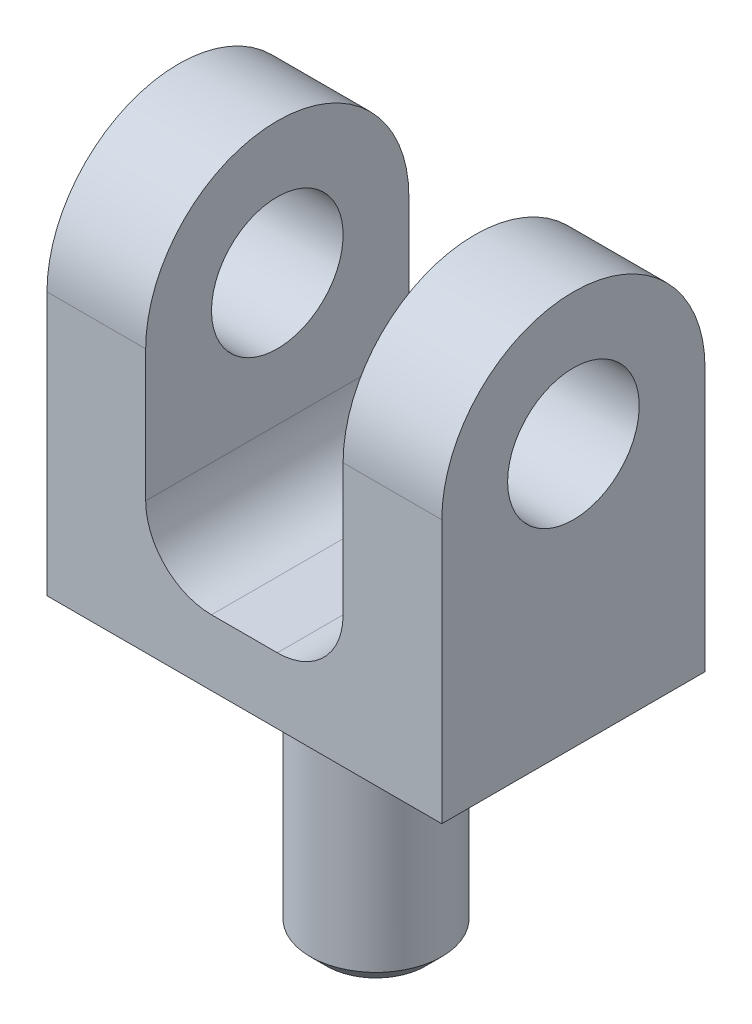
from build123d import *

# Parameters (mm, degrees)
SKETCH1_R               = 3.175
BOSS_EXTRUDE1_DEPTH     = 9.525
SKETCH2_R               = 3.175
BOSS_EXTRUDE2_DEPTH     = 12.7
CHAMFER1_SIZE           = 0.79375
CUT_EXTRUDE1_DEPTH      = 28.86051193
CUT_EXTRUDE1_DEPTH_BACK = 28.86051193
SKETCH3_W               = 9.525
SKETCH3_H               = 15.875
FILLET1_R               = 3.175


with BuildPart() as part:
    # Sketch1 → Boss-Extrude1 (new, symmetric)
    with BuildSketch(Plane(origin=(0, 0, 0), x_dir=(0, 0, -1), z_dir=(1, 0, 0))):
        with BuildLine():
            Line((-6.35, 0), (-6.35, -12.7))
            Line((-6.35, -12.7), (6.35, -12.7))
            Line((6.35, -12.7), (6.35, 0))
            ThreePointArc((6.35, 0), (0, 6.35), (-6.35, 0))
        make_face()
        with Locations(Location((0, 0, 0), (0, 0, 180))):
            Circle(SKETCH1_R, mode=Mode.SUBTRACT)
    extrude(amount=BOSS_EXTRUDE1_DEPTH, both=True)

    # Sketch2 → Boss-Extrude2 (add)
    with BuildSketch(Plane.XZ.offset(12.7)):
        with Locations(Location((0, 0, 0), (0, 0, 90))):
            Circle(SKETCH2_R)
    extrude(amount=BOSS_EXTRUDE2_DEPTH)

    # Chamfer1
    chamfer1_edges = [part.edges().sort_by_distance(p)[0] for p in [
        (0, -25.4, -3.175),
    ]]
    chamfer(chamfer1_edges, length=CHAMFER1_SIZE)

    # Sketch3 → Cut-Extrude1 (cut, two sides: drawn at the far end of the back side and taken through both)
    with BuildSketch(Plane.XY.offset(-CUT_EXTRUDE1_DEPTH_BACK)):
        with Locations((0, -1.5875)):
            Rectangle(SKETCH3_W, SKETCH3_H)
    extrude(amount=CUT_EXTRUDE1_DEPTH + CUT_EXTRUDE1_DEPTH_BACK, mode=Mode.SUBTRACT)

    # Fillet1
    fillet1_edges = [part.edges().sort_by_distance(p)[0] for p in [
        (-4.7625, -9.525, 0),
        (4.7625, -9.525, 0),
    ]]
    fillet(fillet1_edges, radius=FILLET1_R)


solid = part.part
